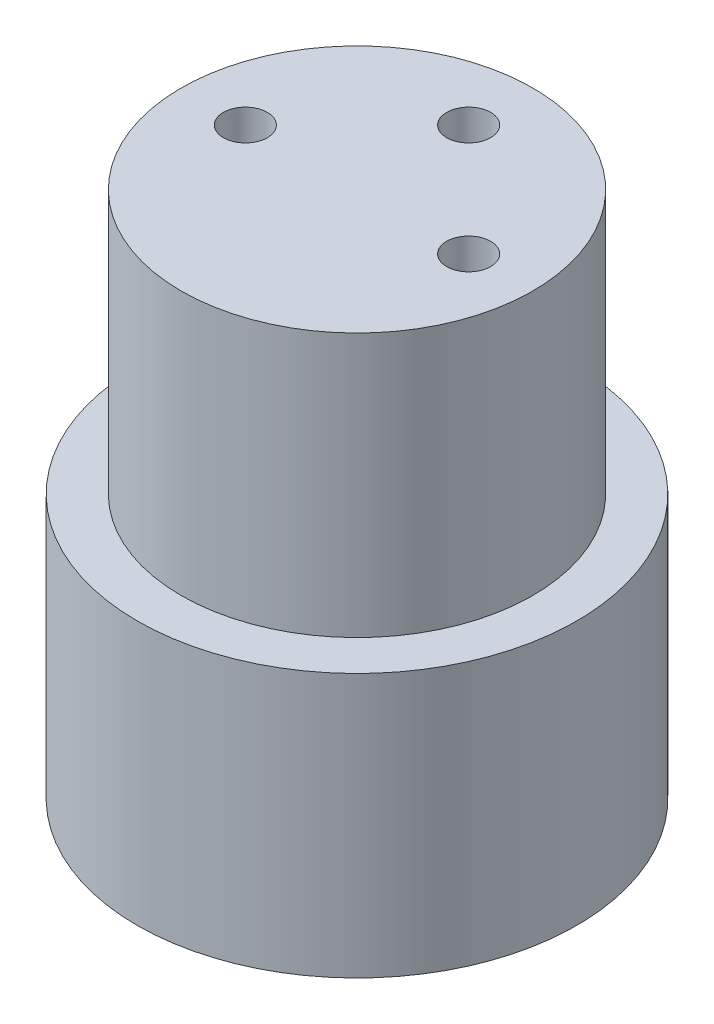
from build123d import *

# Parameters (mm, degrees)
SKETCH_1_R          = 2.5
EXTRUDE_1_DEPTH     = 3
SKETCH_2_R          = 2
EXTRUDE_2_DEPTH     = 3
SKETCH_3_R          = 0.25
CUT_EXTRUDE_1_DEPTH = 10


with BuildPart() as part:
    # Эскиз1 → Бобышка-Вытянуть1 (new body)
    with BuildSketch(Plane(origin=(0, 0, 0), x_dir=(1, 0, 0), z_dir=(0, 1, 0))):
        with Locations(Location((0, 0, 0), (0, 0, 270))):
            Circle(SKETCH_1_R)
    extrude(amount=EXTRUDE_1_DEPTH)

    # Эскиз2 → Бобышка-Вытянуть2 (add)
    with BuildSketch(Plane(origin=(0, 3, 0), x_dir=(1, 0, 0), z_dir=(0, 1, 0))):
        with Locations(Location((0, 0, 0), (0, 0, 270))):
            Circle(SKETCH_2_R)
    extrude(amount=EXTRUDE_2_DEPTH)

    # Эскиз3 → Вырез-Вытянуть1 (cut)
    with BuildSketch(Plane.XZ):
        with Locations(Location((0, -1.27, 0), (0, 0, 270))):
            Circle(SKETCH_3_R)
        with Locations(Location((1.27, 0, 0), (0, 0, 270))):
            Circle(SKETCH_3_R)
        with Locations(Location((-1.27, 0, 0), (0, 0, 270))):
            Circle(SKETCH_3_R)
    extrude(amount=-CUT_EXTRUDE_1_DEPTH, mode=Mode.SUBTRACT)


solid = part.part
